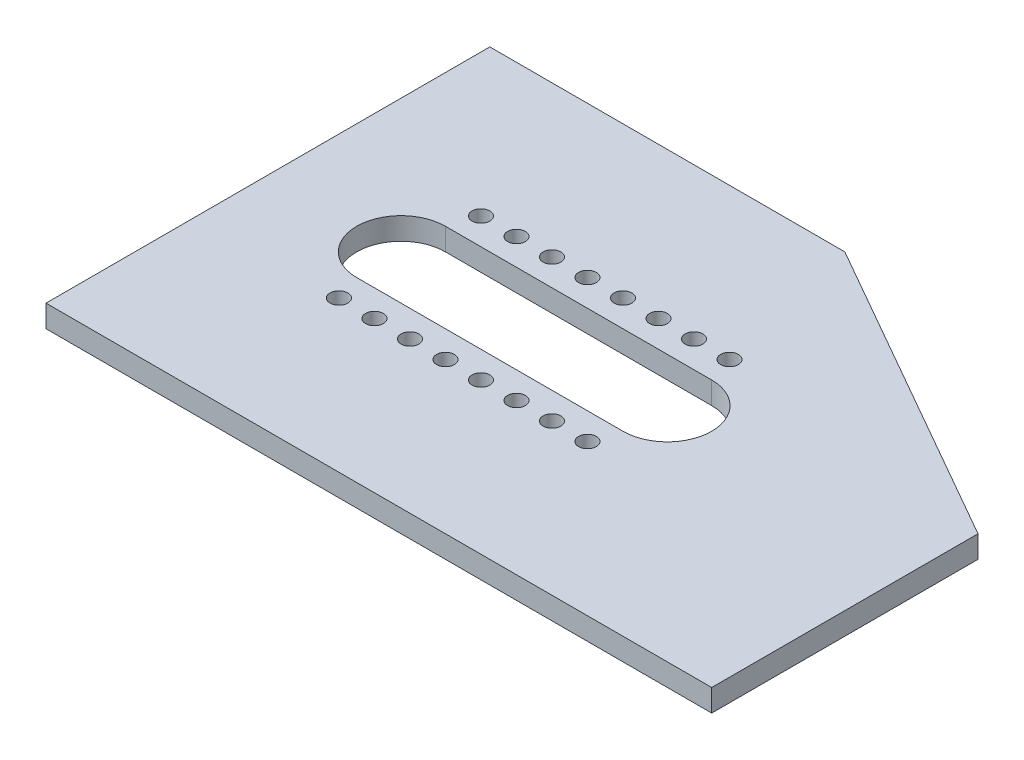
from build123d import *

# Parameters (mm, degrees)
BOSS_EXTRUDE1_DEPTH = 5
SKETCH2_R           = 2
CUT_EXTRUDE1_DEPTH  = 181.346887969


with BuildPart() as part:
    # Sketch1 → Boss-Extrude1 (new body)
    with BuildSketch(Plane(origin=(0, 0, 0), x_dir=(1, 0, 0), z_dir=(0, 1, 0))):
        Polygon((0, 0), (80, 0), (150, -40), (150, -100), (0, -100), align=None)
    extrude(amount=BOSS_EXTRUDE1_DEPTH)

    # Sketch2 → Cut-Extrude1 (cut, through all)
    with BuildSketch(Plane(origin=(0, 5, 0), x_dir=(1, 0, 0), z_dir=(0, 1, 0))):
        with Locations(Location((32, -34, 0), (0, 0, 270))):
            Circle(SKETCH2_R)
        with Locations(Location((40, -34, 0), (0, 0, 270))):
            Circle(SKETCH2_R)
        with Locations(Location((48, -34, 0), (0, 0, 270))):
            Circle(SKETCH2_R)
        with Locations(Location((56, -34, 0), (0, 0, 270))):
            Circle(SKETCH2_R)
        with Locations(Location((64, -34, 0), (0, 0, 270))):
            Circle(SKETCH2_R)
        with Locations(Location((72, -34, 0), (0, 0, 270))):
            Circle(SKETCH2_R)
        with Locations(Location((80, -34, 0), (0, 0, 270))):
            Circle(SKETCH2_R)
        with Locations(Location((88, -34, 0), (0, 0, 270))):
            Circle(SKETCH2_R)
        with Locations(Location((88, -66, 0), (0, 0, 90))):
            Circle(SKETCH2_R)
        with Locations(Location((80, -66, 0), (0, 0, 90))):
            Circle(SKETCH2_R)
        with Locations(Location((72, -66, 0), (0, 0, 90))):
            Circle(SKETCH2_R)
        with Locations(Location((64, -66, 0), (0, 0, 90))):
            Circle(SKETCH2_R)
        with Locations(Location((56, -66, 0), (0, 0, 90))):
            Circle(SKETCH2_R)
        with Locations(Location((48, -66, 0), (0, 0, 90))):
            Circle(SKETCH2_R)
        with Locations(Location((40, -66, 0), (0, 0, 90))):
            Circle(SKETCH2_R)
        with Locations(Location((32, -66, 0), (0, 0, 90))):
            Circle(SKETCH2_R)
        with BuildLine():
            Line((30, -40), (90, -40))
            ThreePointArc((90, -40), (100, -50), (90, -60))
            Line((90, -60), (30, -60))
            ThreePointArc((30, -60), (20, -50), (30, -40))
        make_face()
    extrude(amount=-CUT_EXTRUDE1_DEPTH, mode=Mode.SUBTRACT)


solid = part.part
